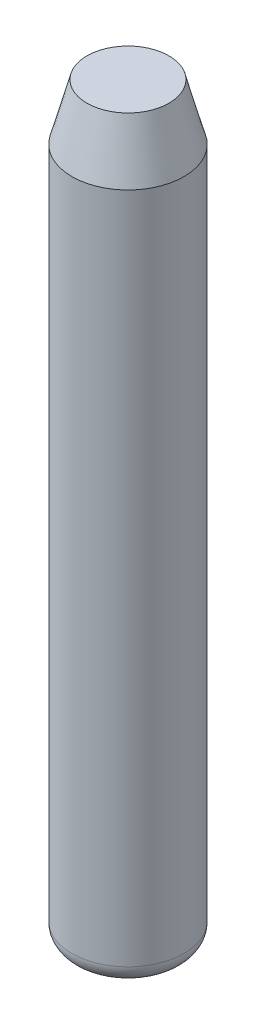
from build123d import *

# Parameters (mm, degrees)
SKETCH1_R           = 1.5
BOSS_EXTRUDE1_DEPTH = 20
CHAMFER1_SIZE       = 1.5
CHAMFER1_SIZE2      = 0.401923789
FILLET1_R           = 0.5


with BuildPart() as part:
    # Sketch1 → Boss-Extrude1 (new body)
    with BuildSketch(Plane(origin=(0, 0, 0), x_dir=(1, 0, 0), z_dir=(0, 1, 0))):
        with Locations(Location((0, 0, 0), (0, 0, 270))):
            Circle(SKETCH1_R)
    extrude(amount=BOSS_EXTRUDE1_DEPTH)

    # Chamfer1
    chamfer1_edges = [part.edges().sort_by_distance(p)[0] for p in [
        (0, 20, -1.5),
    ]]
    chamfer1_side = [part.faces().sort_by_distance(p)[0] for p in [
        (0, 10, -1.5),
    ]]
    chamfer(chamfer1_edges, length=CHAMFER1_SIZE, length2=CHAMFER1_SIZE2, reference=chamfer1_side[0])

    # Fillet1
    fillet1_edges = [part.edges().sort_by_distance(p)[0] for p in [
        (0, 0, -1.5),
    ]]
    fillet(fillet1_edges, radius=FILLET1_R)


solid = part.part
